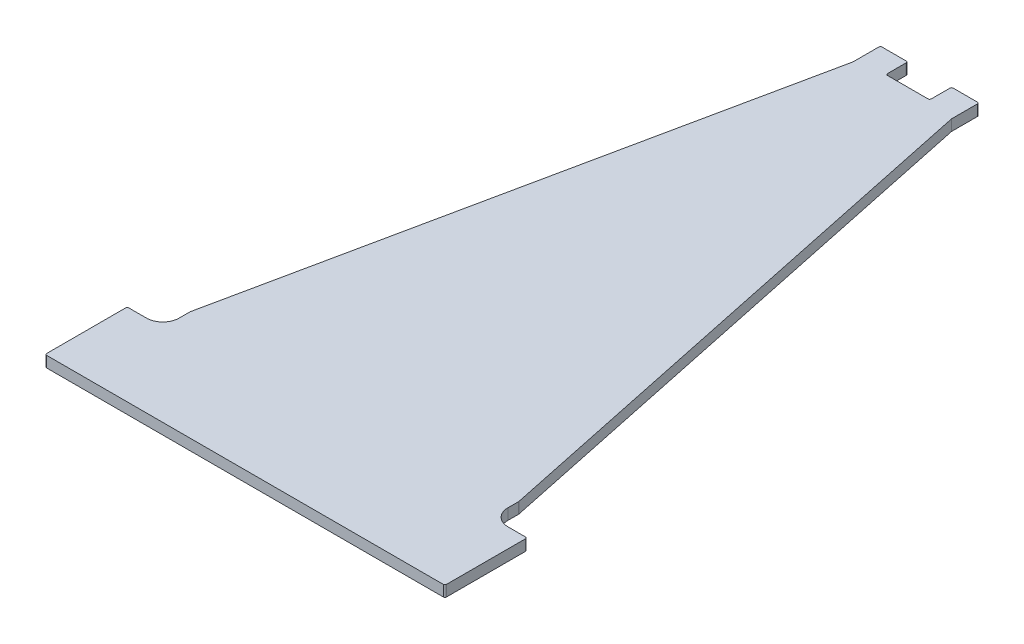
from build123d import *

# Parameters (mm, degrees)
BOSS_EXTRUDE1_DEPTH = 0.2
FILLET1_R           = 0.3
FILLET2_R           = 0.03


with BuildPart() as part:
    # Sketch1 → Boss-Extrude1 (new body)
    with BuildSketch(Plane(origin=(0, 0, 0), x_dir=(1, 0, 0), z_dir=(0, 1, 0))):
        Polygon((0, 0), (0, 1.5), (0.65, 1.5), (0.65, 2), (2.75, 12), (2.75, 12.5), (3.25, 12.5), (3.25, 12.1), (4.05, 12.1), (4.05, 12.5), (4.55, 12.5), (4.55, 12), (6.65, 2), (6.65, 1.5), (7.3, 1.5), (7.3, 0), align=None)
    extrude(amount=BOSS_EXTRUDE1_DEPTH)

    # Fillet1
    fillet1_edges = [part.edges().sort_by_distance(p)[0] for p in [
        (0.65, 0.1, -1.5),
        (6.65, 0.1, -1.5),
    ]]
    fillet(fillet1_edges, radius=FILLET1_R)

    # Fillet2
    fillet2_edges = [part.edges().sort_by_distance(p)[0] for p in [
        (0, 0.1, 0),
        (0, 0.1, -1.5),
        (0.65, 0.1, -2),
        (2.75, 0.1, -12),
        (2.75, 0.1, -12.5),
        (3.25, 0.1, -12.5),
        (3.25, 0.1, -12.1),
        (4.05, 0.1, -12.1),
        (4.05, 0.1, -12.5),
        (4.55, 0.1, -12.5),
        (4.55, 0.1, -12),
        (6.65, 0.1, -2),
        (7.3, 0.1, -1.5),
        (7.3, 0.1, 0),
    ]]
    fillet(fillet2_edges, radius=FILLET2_R)


solid = part.part
